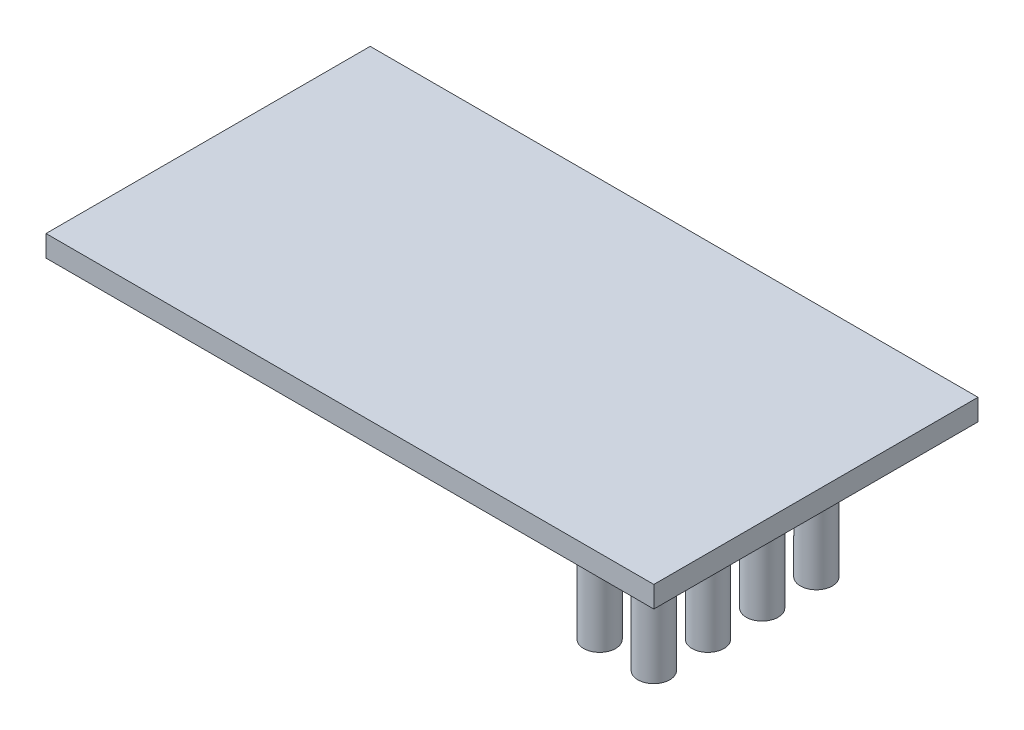
from build123d import *

# Parameters (mm, degrees)
SKETCH1_W           = 28.5
SKETCH1_H           = 15.2
BOSS_EXTRUDE1_DEPTH = 1
SKETCH5_R           = 0.75
BOSS_EXTRUDE4_DEPTH = 5


with BuildPart() as part:
    # Sketch1 → Boss-Extrude1 (new body)
    with BuildSketch(Plane(origin=(0, 0, 0), x_dir=(1, 0, 0), z_dir=(0, 1, 0))):
        with Locations((14.25, 7.6)):
            Rectangle(SKETCH1_W, SKETCH1_H)
    extrude(amount=BOSS_EXTRUDE1_DEPTH)

    # Sketch5 → Boss-Extrude4 (add)
    with BuildSketch(Plane(origin=(0, 1, 0), x_dir=(1, 0, 0), z_dir=(0, 1, 0))):
        with Locations(Location((27, 1.5, 0), (0, 0, 270))):
            Circle(SKETCH5_R)
        with Locations(Location((24.46, 1.5, 0), (0, 0, 270))):
            Circle(SKETCH5_R)
        with Locations(Location((24.46, 4.04, 0), (0, 0, 270))):
            Circle(SKETCH5_R)
        with Locations(Location((27, 4.04, 0), (0, 0, 270))):
            Circle(SKETCH5_R)
        with Locations(Location((24.46, 6.58, 0), (0, 0, 270))):
            Circle(SKETCH5_R)
        with Locations(Location((27, 6.58, 0), (0, 0, 270))):
            Circle(SKETCH5_R)
        with Locations(Location((24.46, 9.12, 0), (0, 0, 270))):
            Circle(SKETCH5_R)
        with Locations(Location((27, 9.12, 0), (0, 0, 270))):
            Circle(SKETCH5_R)
    extrude(amount=-BOSS_EXTRUDE4_DEPTH)


solid = part.part
